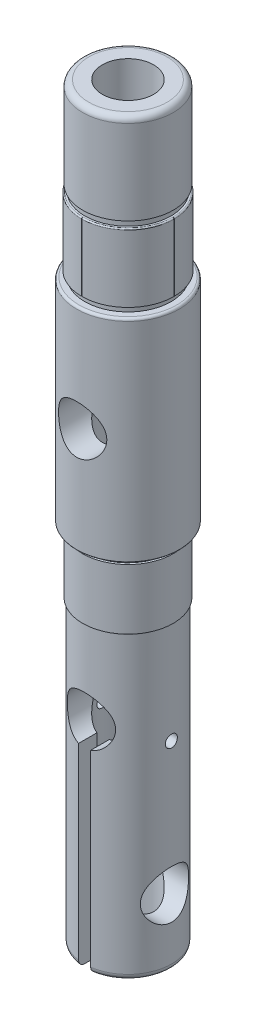
from build123d import *

# Parameters (mm, degrees)
SKETCH4_R               = 4.25
CUT_EXTRUDE1_DEPTH      = 125.87990232
SKETCH5_R               = 4
CUT_EXTRUDE2_DEPTH      = 125.87990232
CUT_EXTRUDE3_DEPTH      = 125.879902419
CUT_EXTRUDE4_DEPTH      = 125.879902419
CUT_EXTRUDE4_DEPTH_BACK = 125.879902419
SKETCH8_R               = 4
SKETCH8_R_2             = 1
SKETCH9_R               = 0.75
CUT_EXTRUDE5_DEPTH      = 125.879902419
CUT_EXTRUDE6_START      = -11.3
CUT_EXTRUDE6_DEPTH      = 11.3


with BuildPart() as part:
    # Sketch3 → Revolve1 (revolve)
    with BuildSketch(Plane.XY, mode=Mode.PRIVATE) as revolve1_sk:
        with BuildLine():
            Line((0, 0), (0, 124.3))
            Line((0, 124.3), (-6.5, 124.3))
            ThreePointArc((-6.5, 124.3), (-7.207106781, 124.007106781), (-7.5, 123.3))
            Line((-7.5, 123.3), (-7.5, 109.3))
            Line((-7.5, 109.3), (-7.15, 109.3))
            Line((-7.15, 109.3), (-7.15, 108.3))
            Line((-7.15, 108.3), (-7.45, 108.3))
            ThreePointArc((-7.45, 108.3), (-7.591421356, 108.241421356), (-7.65, 108.1))
            Line((-7.65, 108.1), (-7.65, 97))
            Line((-7.65, 97), (-7.15, 97))
            Line((-7.15, 97), (-7.15, 96))
            Line((-7.15, 96), (-8.1, 96))
            ThreePointArc((-8.1, 96), (-8.382842712, 95.882842712), (-8.5, 95.6))
            Line((-8.5, 95.6), (-8.5, 61.1))
            ThreePointArc((-8.5, 61.1), (-8.470710678, 61.029289322), (-8.4, 61))
            Line((-8.4, 61), (-7.35, 61))
            ThreePointArc((-7.35, 61), (-7.208578644, 60.941421356), (-7.15, 60.8))
            Line((-7.15, 60.8), (-7.15, 60))
            Line((-7.15, 60), (-7.5, 60))
            Line((-7.5, 60), (-7.5, 50))
            Line((-7.5, 50), (-7.45, 50))
            ThreePointArc((-7.45, 50), (-7.308578644, 49.941421356), (-7.25, 49.8))
            Line((-7.25, 49.8), (-7.25, 1))
            ThreePointArc((-7.25, 1), (-6.957106781, 0.292893219), (-6.25, 0))
            Line((-6.25, 0), (0, 0))
        make_face()
    revolve(revolve1_sk.sketch.rotate(Axis((0, 68.734833091, 0), (0, -1, 0)), 270), axis=Axis((0, 68.734833091, 0), (0, -1, 0)))

    # Sketch4 → Cut-Extrude1 (cut, through all)
    with BuildSketch(Plane(origin=(0, 124.3, 0), x_dir=(1, 0, 0), z_dir=(0, 1, 0))):
        with Locations(Location((0, 0, 0), (0, 0, 270))):
            Circle(SKETCH4_R)
    extrude(amount=-CUT_EXTRUDE1_DEPTH, mode=Mode.SUBTRACT)

    # Sketch5 → Cut-Extrude2 (cut, through all)
    with BuildSketch(Plane.XY):
        with Locations(Location((0, 78.35, 0), (0, 0, 270))):
            Circle(SKETCH5_R)
    extrude(amount=CUT_EXTRUDE2_DEPTH, mode=Mode.SUBTRACT)

    # Sketch7 → Cut-Extrude3 (cut, through all)
    with BuildSketch(Plane.XY):
        with BuildLine():
            Line((0, 0), (-1, 0))
            Line((-1, 0), (-1, 32.127016654))
            ThreePointArc((-1, 32.127016654), (0, 40), (1, 32.127016654))
            Line((1, 32.127016654), (1, 0))
            Line((1, 0), (0, 0))
        make_face()
    extrude(amount=CUT_EXTRUDE3_DEPTH, mode=Mode.SUBTRACT)

    # Sketch8 → Cut-Extrude4 (cut, two sides: drawn at the far end of the back side and taken through both)
    with BuildSketch(Plane(origin=(0, 0, 0), x_dir=(0, 0, -1), z_dir=(1, 0, 0)).offset(-CUT_EXTRUDE4_DEPTH_BACK)):
        with Locations((0, 11)):
            Circle(SKETCH8_R)
        with Locations((0, 33)):
            Circle(SKETCH8_R_2)
    extrude(amount=CUT_EXTRUDE4_DEPTH + CUT_EXTRUDE4_DEPTH_BACK, mode=Mode.SUBTRACT)

    # Sketch9 → Cut-Extrude5 (cut, through all)
    with BuildSketch(Plane.XY):
        with Locations((0, 36)):
            Circle(SKETCH9_R)
    extrude(amount=-CUT_EXTRUDE5_DEPTH, mode=Mode.SUBTRACT)

    # Sketch10 → Cut-Extrude6 (cut)
    with BuildSketch(Plane(origin=(0, 108.3, 0), x_dir=(1, 0, 0), z_dir=(0, 1, 0)).offset(CUT_EXTRUDE6_START)):
        with BuildLine():
            ThreePointArc((-0.03272482, 7.499928605), (0, 7.5), (0.03272482, 7.499928605))
            Line((0.03272482, 7.499928605), (0.033379316, 7.649927178))
            ThreePointArc((0.033379316, 7.649927178), (0, 7.65), (-0.033379316, 7.649927178))
            Line((-0.033379316, 7.649927178), (-0.03272482, 7.499928605))
        make_face()
        with BuildLine():
            ThreePointArc((7.499928605, 0.03272482), (7.5, 0), (7.499928605, -0.03272482))
            Line((7.499928605, -0.03272482), (7.649927178, -0.033379316))
            ThreePointArc((7.649927178, -0.033379316), (7.65, 0), (7.649927178, 0.033379316))
            Line((7.649927178, 0.033379316), (7.499928605, 0.03272482))
        make_face()
        with BuildLine():
            ThreePointArc((0.03272482, -7.499928605), (0, -7.5), (-0.03272482, -7.499928605))
            Line((-0.03272482, -7.499928605), (-0.033379316, -7.649927178))
            ThreePointArc((-0.033379316, -7.649927178), (0, -7.65), (0.033379316, -7.649927178))
            Line((0.033379316, -7.649927178), (0.03272482, -7.499928605))
        make_face()
        with BuildLine():
            ThreePointArc((-7.499928605, -0.03272482), (-7.5, 0), (-7.499928605, 0.03272482))
            Line((-7.499928605, 0.03272482), (-7.649927178, 0.033379316))
            ThreePointArc((-7.649927178, 0.033379316), (-7.65, 0), (-7.649927178, -0.033379316))
            Line((-7.649927178, -0.033379316), (-7.499928605, -0.03272482))
        make_face()
    extrude(amount=CUT_EXTRUDE6_DEPTH, mode=Mode.SUBTRACT)


solid = part.part
